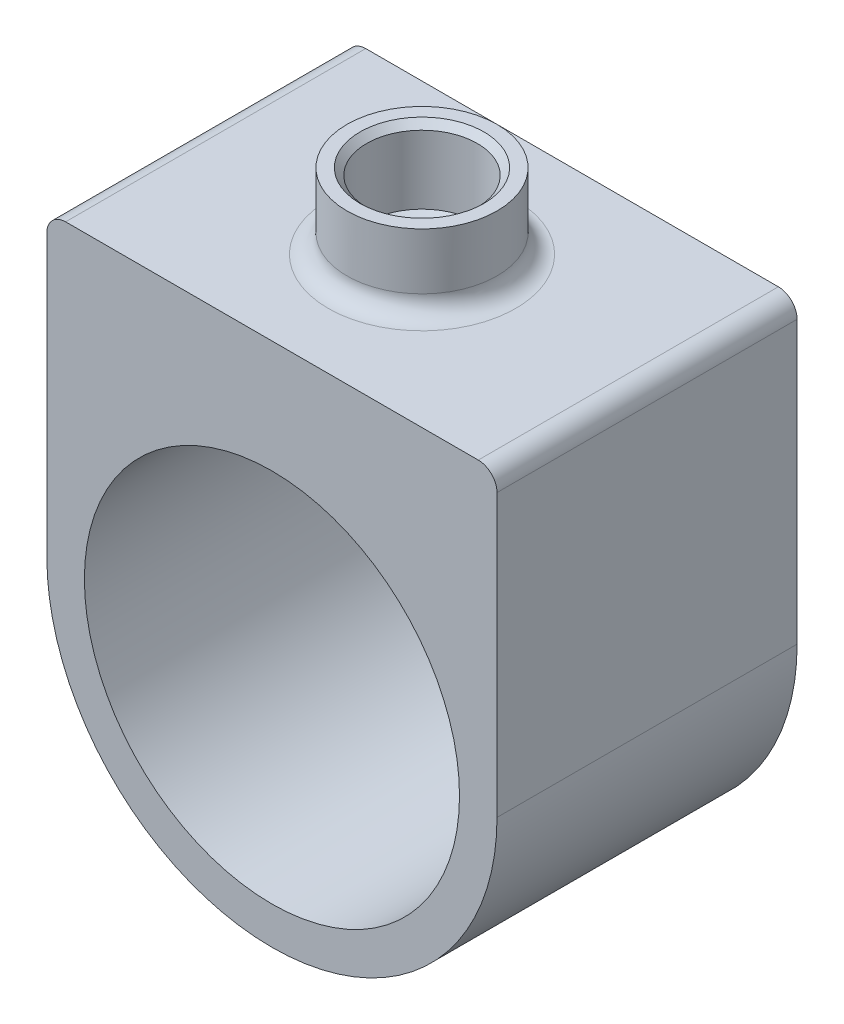
from build123d import *

# Parameters (mm, degrees)
SKETCH1_R                    = 50
BOSS_EXTRUDE1_DEPTH          = 40
FILLET1_R                    = 5
SKETCH2_R                    = 20
BOSS_EXTRUDE2_DEPTH          = 20
M33_TAPPED_HOLE1_D           = 29.5
M33_TAPPED_HOLE1_DEPTH       = 20
M33_TAPPED_HOLE1_CSINK_D     = 33.05
M33_TAPPED_HOLE1_CSINK_ANGLE = 90
M33_TAPPED_HOLE1_TIP         = 8.862694131
FILLET2_R                    = 5


with BuildPart() as part:
    # Sketch1 → Boss-Extrude1 (new, symmetric)
    with BuildSketch(Plane.XY):
        with BuildLine():
            Line((-60, 0), (-60, 80))
            Line((-60, 80), (60, 80))
            Line((60, 80), (60, 0))
            ThreePointArc((60, 0), (0, -60), (-60, 0))
        make_face()
        Circle(SKETCH1_R, mode=Mode.SUBTRACT)
    extrude(amount=BOSS_EXTRUDE1_DEPTH, both=True)

    # Fillet1
    fillet1_edges = [part.edges().sort_by_distance(p)[0] for p in [
        (-60, 80, 0),
        (60, 80, 0),
    ]]
    fillet(fillet1_edges, radius=FILLET1_R)

    # Sketch2 → Boss-Extrude2 (add)
    with BuildSketch(Plane(origin=(0, 80, 0), x_dir=(1, 0, 0), z_dir=(0, 1, 0))):
        with Locations(Location((0, 0, 0), (0, 0, 90))):
            Circle(SKETCH2_R)
    extrude(amount=BOSS_EXTRUDE2_DEPTH)

    # M33 Tapped Hole1
    with Locations(Plane.ZX.offset(100)):
        with Locations((0, 0)):
            CounterSinkHole(M33_TAPPED_HOLE1_D / 2, M33_TAPPED_HOLE1_CSINK_D / 2, depth=M33_TAPPED_HOLE1_DEPTH, counter_sink_angle=M33_TAPPED_HOLE1_CSINK_ANGLE)
            with Locations((0, 0, -(M33_TAPPED_HOLE1_DEPTH + M33_TAPPED_HOLE1_TIP / 2))):  # 118° drill point
                Cone(0, M33_TAPPED_HOLE1_D / 2, M33_TAPPED_HOLE1_TIP, mode=Mode.SUBTRACT)

    # Fillet2
    fillet2_edges = [part.edges().sort_by_distance(p)[0] for p in [
        (0, 80, 20),
    ]]
    fillet(fillet2_edges, radius=FILLET2_R)


solid = part.part
